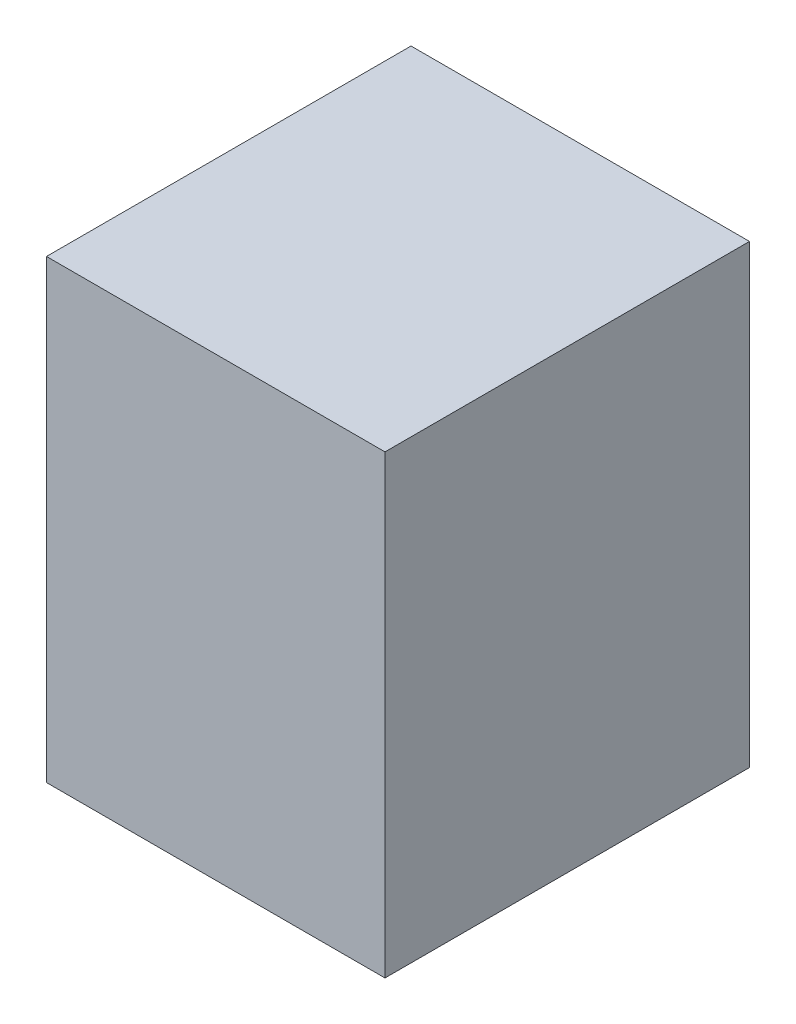
from build123d import *

# Parameters (mm, degrees)
SKETCH1_W           = 330.2
SKETCH1_H           = 355.6
BOSS_EXTRUDE1_DEPTH = 444.5


with BuildPart() as part:
    # Sketch1 → Boss-Extrude1 (new body)
    with BuildSketch(Plane(origin=(0, 0, 0), x_dir=(1, 0, 0), z_dir=(0, 1, 0))):
        Rectangle(SKETCH1_W, SKETCH1_H)
    extrude(amount=BOSS_EXTRUDE1_DEPTH)


solid = part.part
